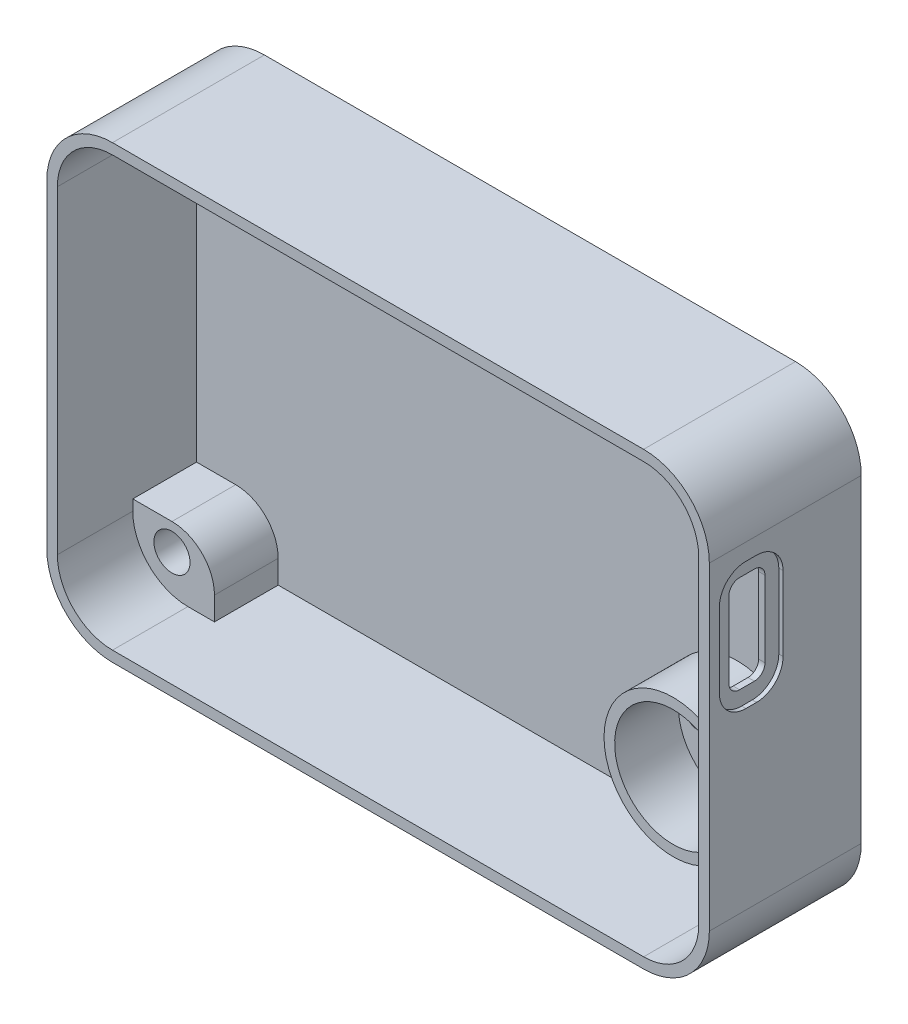
from build123d import *

# Parameters (mm, degrees)
SKETCH_10_R         = 1.7
EXTRUDE_5_DEPTH     = 6
EXTRUDE_6_DEPTH     = 1.2
EXTRUDE_START       = -7.1
EXTRUDE_7_DEPTH     = 7.1
CUT_EXTRUDE_3_REACH = 209.716
CUT_EXTRUDE_4_DEPTH = 0.4
EXTRUDE_START_2     = 6
EXTRUDE_8_DEPTH     = 6
SKETCH_15_R         = 2
SKETCH_15_R_2       = 1
CUT_EXTRUDE_5_DEPTH = 1.2


with BuildPart() as part:
    # 草图10 → 凸台-拉伸5 (new body)
    with BuildSketch(Plane(origin=(0, 0, 53.48299881), x_dir=(-1, 0, 0), z_dir=(0, 0, -1))):
        with BuildLine():
            ThreePointArc((9.233430205, 182.453191023), (7.421209024, 186.828279976), (3.04612007, 188.640501158))
            Line((3.04612007, 188.640501158), (-46.95397899, 188.640501158))
            ThreePointArc((-46.95397899, 188.640501158), (-51.329067943, 186.828279976), (-53.141289124, 182.453191023))
            Line((-53.141289124, 182.453191023), (-53.141289124, 152.453132603))
            ThreePointArc((-53.141289124, 152.453132603), (-51.329067943, 148.078043649), (-46.95397899, 146.265822468))
            Line((-46.95397899, 146.265822468), (3.04612007, 146.265822468))
            ThreePointArc((3.04612007, 146.265822468), (7.421209024, 148.078043649), (9.233430205, 152.453132603))
            Line((9.233430205, 152.453132603), (9.233430205, 182.453191023))
        make_face()
        with BuildLine():
            ThreePointArc((0.54612261, 185.453196103), (1.717695486, 182.624768978), (4.54612261, 181.453196103))
            Line((4.54612261, 181.453196103), (8.233430205, 181.453196103))
            Line((8.233430205, 181.453196103), (8.233430205, 153.453127523))
            Line((8.233430205, 153.453127523), (4.54612261, 153.453127523))
            ThreePointArc((4.54612261, 153.453127523), (1.717695486, 152.281554648), (0.54612261, 149.453127523))
            Line((0.54612261, 149.453127523), (0.54612261, 147.265822468))
            Line((0.54612261, 147.265822468), (-45.95398153, 147.265822468))
            Line((-45.95398153, 147.265822468), (-45.95398153, 150.953127523))
            ThreePointArc((-45.95398153, 150.953127523), (-46.686214577, 152.720894476), (-48.45398153, 153.453127523))
            Line((-48.45398153, 153.453127523), (-52.141289124, 153.453127523))
            Line((-52.141289124, 153.453127523), (-52.141289124, 180.953183403))
            Line((-52.141289124, 180.953183403), (-48.45399423, 180.953183403))
            ThreePointArc((-48.45399423, 180.953183403), (-46.332673886, 181.831863059), (-45.45399423, 183.953183403))
            Line((-45.45399423, 183.953183403), (-45.45399423, 187.640501158))
            Line((-45.45399423, 187.640501158), (0.54612261, 187.640501158))
            Line((0.54612261, 187.640501158), (0.54612261, 185.453196103))
        make_face(mode=Mode.SUBTRACT)
        with Locations((4.54610737, 183.953163083)):
            Circle(SKETCH_10_R, mode=Mode.SUBTRACT)
        with Locations((-48.45399423, 183.953183403)):
            Circle(SKETCH_10_R, mode=Mode.SUBTRACT)
        with Locations((-48.45399423, 150.953140223)):
            Circle(SKETCH_10_R, mode=Mode.SUBTRACT)
        with Locations((4.54610737, 150.953160543)):
            Circle(SKETCH_10_R, mode=Mode.SUBTRACT)
    extrude(amount=EXTRUDE_5_DEPTH)

    # 草图11 → 凸台-拉伸6 (add)
    with BuildSketch(Plane(origin=(0, 0, 47.48299881), x_dir=(-1, 0, 0), z_dir=(0, 0, -1))):
        with BuildLine():
            Line((9.233430205, 152.453132603), (9.233430205, 182.453191023))
            ThreePointArc((9.233430205, 182.453191023), (7.421209024, 186.828279976), (3.04612007, 188.640501158))
            Line((3.04612007, 188.640501158), (-46.95397899, 188.640501158))
            ThreePointArc((-46.95397899, 188.640501158), (-51.329067943, 186.828279976), (-53.141289124, 182.453191023))
            Line((-53.141289124, 182.453191023), (-53.141289124, 152.453132603))
            ThreePointArc((-53.141289124, 152.453132603), (-51.329067943, 148.078043649), (-46.95397899, 146.265822468))
            Line((-46.95397899, 146.265822468), (3.04612007, 146.265822468))
            ThreePointArc((3.04612007, 146.265822468), (7.421209024, 148.078043649), (9.233430205, 152.453132603))
        make_face()
    extrude(amount=EXTRUDE_6_DEPTH)

    # 草图10<4> → 凸台-拉伸7 (add)
    with BuildSketch(Plane(origin=(0, 0, 53.48299881), x_dir=(-1, 0, 0), z_dir=(0, 0, -1)).offset(EXTRUDE_START)):
        with BuildLine():
            Line((9.233430205, 152.453132603), (9.233430205, 182.453191023))
            ThreePointArc((9.233430205, 182.453191023), (7.421209024, 186.828279976), (3.04612007, 188.640501158))
            Line((3.04612007, 188.640501158), (-46.95397899, 188.640501158))
            ThreePointArc((-46.95397899, 188.640501158), (-51.329067943, 186.828279976), (-53.141289124, 182.453191023))
            Line((-53.141289124, 182.453191023), (-53.141289124, 152.453132603))
            ThreePointArc((-53.141289124, 152.453132603), (-51.329067943, 148.078043649), (-46.95397899, 146.265822468))
            Line((-46.95397899, 146.265822468), (3.04612007, 146.265822468))
            ThreePointArc((3.04612007, 146.265822468), (7.421209024, 148.078043649), (9.233430205, 152.453132603))
        make_face()
        with BuildLine():
            ThreePointArc((8.233430205, 182.453191023), (6.714102243, 186.121173195), (3.04612007, 187.640501158))
            Line((3.04612007, 187.640501158), (-46.95397899, 187.640501158))
            ThreePointArc((-46.95397899, 187.640501158), (-50.621961162, 186.121173195), (-52.141289124, 182.453191023))
            Line((-52.141289124, 182.453191023), (-52.141289124, 152.453132603))
            ThreePointArc((-52.141289124, 152.453132603), (-50.621961162, 148.78515043), (-46.95397899, 147.265822468))
            Line((-46.95397899, 147.265822468), (3.04612007, 147.265822468))
            ThreePointArc((3.04612007, 147.265822468), (6.714102243, 148.78515043), (8.233430205, 152.453132603))
            Line((8.233430205, 152.453132603), (8.233430205, 182.453191023))
        make_face(mode=Mode.SUBTRACT)
    extrude(amount=EXTRUDE_7_DEPTH)

    # 草图12 → 切除-拉伸3 (cut, up to next)
    with BuildSketch(Plane(origin=(53.141289124, 0, 0), x_dir=(0, 0, -1), z_dir=(1, 0, 0)), mode=Mode.PRIVATE) as cut_extrude_3_sk1:
        with BuildLine():
            Line((-57.343049783, 179.450176225), (-55.943049648, 179.450176225))
            ThreePointArc((-55.943049648, 179.450176225), (-55.235942867, 179.157283006), (-54.943049648, 178.450176225))
            Line((-54.943049648, 178.450176225), (-54.943049648, 171.310175849))
            ThreePointArc((-54.943049648, 171.310175849), (-55.235942867, 170.603069068), (-55.943049648, 170.310175849))
            Line((-55.943049648, 170.310175849), (-57.343049783, 170.310175849))
            ThreePointArc((-57.343049783, 170.310175849), (-58.050156564, 170.603069068), (-58.343049783, 171.310175849))
            Line((-58.343049783, 171.310175849), (-58.343049783, 178.450176225))
            ThreePointArc((-58.343049783, 178.450176225), (-58.050156564, 179.157283006), (-57.343049783, 179.450176225))
        make_face()
    cut_extrude_3_tool1 = extrude(cut_extrude_3_sk1.sketch, amount=-CUT_EXTRUDE_3_REACH, mode=Mode.PRIVATE) & part.part
    add(cut_extrude_3_tool1.solids().sort_by_distance((53.141289, 174.880176, 56.64305))[0], mode=Mode.SUBTRACT)

    # 草图13 → 切除-拉伸4 (cut)
    with BuildSketch(Plane(origin=(53.141289124, 0, 0), x_dir=(0, 0, -1), z_dir=(1, 0, 0))):
        with BuildLine():
            Line((-57.143049715, 180.880176037), (-56.143049715, 180.880176037))
            ThreePointArc((-56.143049715, 180.880176037), (-54.375282762, 180.14794299), (-53.643049715, 178.380176037))
            Line((-53.643049715, 178.380176037), (-53.643049715, 171.380176037))
            ThreePointArc((-53.643049715, 171.380176037), (-54.375282762, 169.612409084), (-56.143049715, 168.880176037))
            Line((-56.143049715, 168.880176037), (-57.143049715, 168.880176037))
            ThreePointArc((-57.143049715, 168.880176037), (-58.910816668, 169.612409084), (-59.643049715, 171.380176037))
            Line((-59.643049715, 171.380176037), (-59.643049715, 178.380176037))
            ThreePointArc((-59.643049715, 178.380176037), (-58.910816668, 180.14794299), (-57.143049715, 180.880176037))
        make_face()
    extrude(amount=-CUT_EXTRUDE_4_DEPTH, mode=Mode.SUBTRACT)

    # 草图14 → 凸台-拉伸8 (add)
    with BuildSketch(Plane.XY.offset(47.48299881).offset(EXTRUDE_START_2)):
        with BuildLine():
            ThreePointArc((46.196138585, 152.026507807), (37.131275676, 156.428908647), (46.516064334, 160.100231917))
            ThreePointArc((46.516064334, 160.100231917), (47.708316282, 158.315900782), (48.12697949, 156.211138699))
            ThreePointArc((48.12697949, 156.211138699), (47.878381245, 154.576273637), (47.155059599, 153.089199108))
            ThreePointArc((47.155059599, 153.089199108), (47.779510983, 153.360426732), (48.45398153, 153.453127523))
            Line((48.45398153, 153.453127523), (48.512842608, 153.453127523))
            ThreePointArc((48.512842608, 153.453127523), (48.971587844, 154.79835866), (49.12697949, 156.211138699))
            ThreePointArc((49.12697949, 156.211138699), (36.975612676, 159.422408955), (45.95398153, 150.627133812))
            Line((45.95398153, 150.627133812), (45.95398153, 150.953127523))
            ThreePointArc((45.95398153, 150.953127523), (46.0152721, 151.503305965), (46.196138585, 152.026507807))
        make_face()
    extrude(amount=-EXTRUDE_8_DEPTH)

    # 草图15 → 切除-拉伸5 (cut)
    with BuildSketch(Plane(origin=(0, 0, 46.28299881), x_dir=(-1, 0, 0), z_dir=(0, 0, -1))):
        with Locations((-42.647049867, 156.215638701)):
            Circle(SKETCH_15_R)
        with Locations((-46.426971116, 156.211138699)):
            Circle(SKETCH_15_R_2)
        with Locations((-42.651549869, 159.995559949)):
            Circle(SKETCH_15_R_2)
        with Locations((-38.867128618, 156.220138702)):
            Circle(SKETCH_15_R_2)
        with Locations((-42.642549865, 152.435717452)):
            Circle(SKETCH_15_R_2)
    extrude(amount=-CUT_EXTRUDE_5_DEPTH, mode=Mode.SUBTRACT)


solid = part.part
